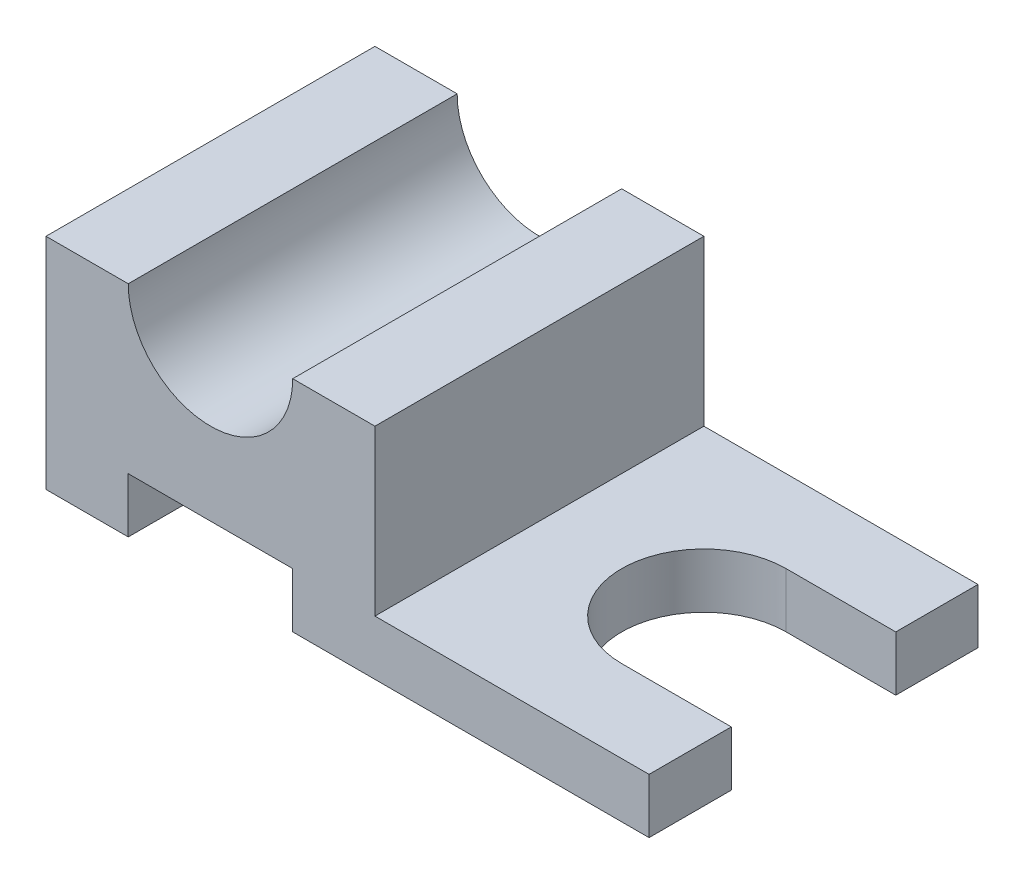
from build123d import *

# Parameters (mm, degrees)
BOSS_EXTRUDE1_DEPTH = 60
CUT_EXTRUDE1_DEPTH  = 10


with BuildPart() as part:
    # Sketch1 → Boss-Extrude1 (new body)
    with BuildSketch(Plane.XY):
        with BuildLine():
            ThreePointArc((-99.174546015, -18.724184061), (-84.174546015, -33.724184061), (-69.174546015, -18.724184061))
            Line((-69.174546015, -18.724184061), (-54.174546015, -18.724184061))
            Line((-54.174546015, -18.724184061), (-54.174546015, -48.724184061))
            Line((-54.174546015, -48.724184061), (-4.174546015, -48.724184061))
            Line((-4.174546015, -48.724184061), (-4.174546015, -58.724184061))
            Line((-4.174546015, -58.724184061), (-69.174546015, -58.724184061))
            Line((-69.174546015, -58.724184061), (-69.174546015, -48.724184061))
            Line((-69.174546015, -48.724184061), (-99.174546015, -48.724184061))
            Line((-99.174546015, -48.724184061), (-99.174546015, -58.724184061))
            Line((-99.174546015, -58.724184061), (-114.174546015, -58.724184061))
            Line((-114.174546015, -58.724184061), (-114.174546015, -18.724184061))
            Line((-114.174546015, -18.724184061), (-99.174546015, -18.724184061))
        make_face()
    extrude(amount=BOSS_EXTRUDE1_DEPTH)

    # Sketch2 → Cut-Extrude1 (cut)
    with BuildSketch(Plane(origin=(0, -48.724184061, 0), x_dir=(1, 0, 0), z_dir=(0, 1, 0))):
        with BuildLine():
            Line((-4.174546015, -15), (-4.174546015, -45))
            Line((-4.174546015, -45), (-24.174546015, -45))
            ThreePointArc((-24.174546015, -45), (-39.174546015, -30), (-24.174546015, -15))
            Line((-24.174546015, -15), (-4.174546015, -15))
        make_face()
    extrude(amount=-CUT_EXTRUDE1_DEPTH, mode=Mode.SUBTRACT)


solid = part.part
